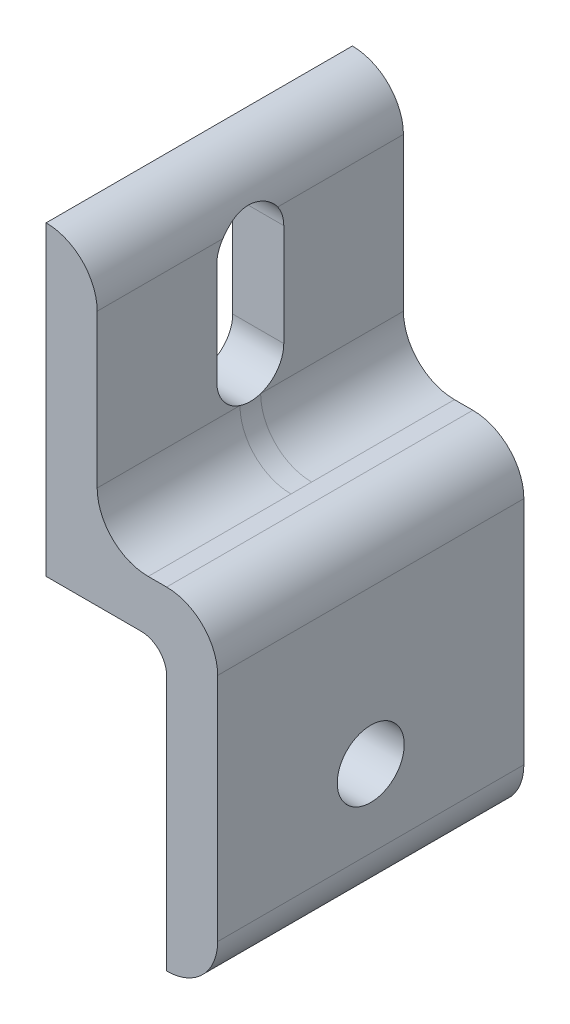
from build123d import *

# Parameters (mm, degrees)
BOSS_EXTRUDE1_DEPTH      = 38.1
CUT_EXTRUDE1_DEPTH       = 48.641761051
F_5_16_CLEARANCE_HOLE1_D = 8.3312
FILLET1_R                = 3.175
FILLET2_R                = 6.35


with BuildPart() as part:
    # Sketch1 → Boss-Extrude1 (new body)
    with BuildSketch(Plane.XY.offset(19.05)):
        with BuildLine():
            Line((0, 38.1), (0, 0))
            Line((0, 0), (14.986, 0))
            Line((14.986, 0), (14.986, -35.0266))
            ThreePointArc((14.986, -35.0266), (19.476128061, -33.166728061), (21.336, -28.6766))
            Line((21.336, -28.6766), (21.336, 6.35))
            Line((21.336, 6.35), (6.35, 6.35))
            Line((6.35, 6.35), (6.35, 31.75))
            ThreePointArc((6.35, 31.75), (4.490128061, 36.240128061), (0, 38.1))
        make_face()
    extrude(amount=-BOSS_EXTRUDE1_DEPTH)

    # Sketch2 → Cut-Extrude1 (cut, through all)
    with BuildSketch(Plane.ZY):
        with BuildLine():
            Line((-4.1656, 29.3624), (-4.1656, 16.6624))
            ThreePointArc((-4.1656, 16.6624), (0, 12.4968), (4.1656, 16.6624))
            Line((4.1656, 16.6624), (4.1656, 29.3624))
            ThreePointArc((4.1656, 29.3624), (0, 33.528), (-4.1656, 29.3624))
        make_face()
    extrude(amount=-CUT_EXTRUDE1_DEPTH, mode=Mode.SUBTRACT)

    # 5/16 Clearance Hole1 (through all)
    with Locations(Plane.ZY.offset(-14.986)):
        with Locations((0, -19.05)):
            Hole(F_5_16_CLEARANCE_HOLE1_D / 2)

    # Fillet1
    fillet1_edges = [part.edges().sort_by_distance(p)[0] for p in [
        (14.986, 0, 0),
    ]]
    fillet(fillet1_edges, radius=FILLET1_R)

    # Fillet2
    fillet2_edges = [part.edges().sort_by_distance(p)[0] for p in [
        (6.35, 6.35, 0),
        (21.336, 6.35, 0),
    ]]
    fillet(fillet2_edges, radius=FILLET2_R)


solid = part.part
